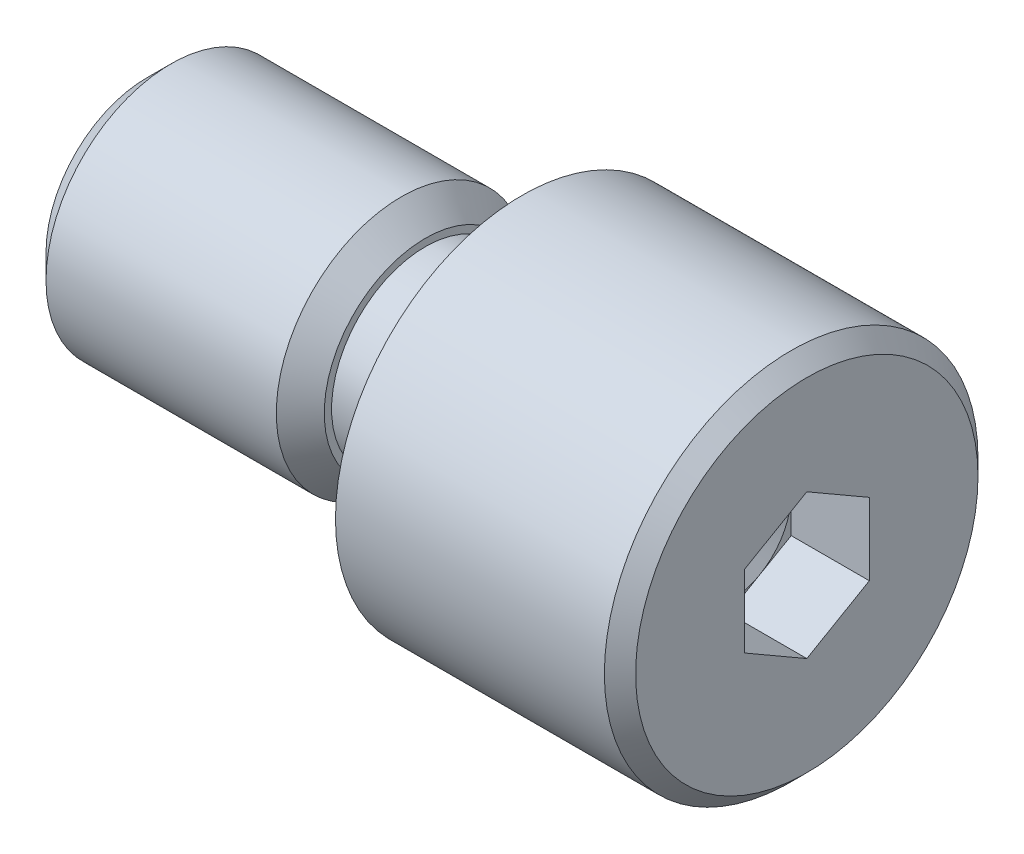
from build123d import *

# Parameters (mm, degrees)
CUT_EXTRUDE1_DEPTH = 2.5
CHAMFER1_SIZE      = 0.767
CHAMFER2_SIZE      = 0.5
FILLET1_R          = 0.2


with BuildPart() as part:
    # Sketch1 → Revolve1 (revolve)
    with BuildSketch(Plane.XY, mode=Mode.PRIVATE) as revolve1_sk:
        Polygon((0, 4), (0, 0), (21.1, 0), (21.1, 5.975), (12, 5.975), (12, 3), (8.9, 3), (8.9, 4), align=None)
    revolve(revolve1_sk.sketch.rotate(Axis((0, 0, 0), (1, 0, 0)), 270), axis=Axis((0, 0, 0), (1, 0, 0)))

    # Sketch2 → Cut-Extrude1 (cut)
    with BuildSketch(Plane(origin=(21.1, 0, 0), x_dir=(0, 0, -1), z_dir=(1, 0, 0))):
        Polygon((0, -2.309401077), (2, -1.154700538), (2, 1.154700538), (0, 2.309401077), (-2, 1.154700538), (-2, -1.154700538), align=None)
    extrude(amount=-CUT_EXTRUDE1_DEPTH, mode=Mode.SUBTRACT)

    # Sketch3 → Cut-Revolve1 (revolve, cut)
    with BuildSketch(Plane(origin=(0, 0, 0), x_dir=(-1, 0, 0), z_dir=(0, 0, -1)), mode=Mode.PRIVATE) as cut_revolve1_sk:
        Polygon((-18.6, 2), (-18.6, 0), (-17.445299462, 0), align=None)
    revolve(cut_revolve1_sk.sketch.rotate(Axis((18.600025, 0, 0), (-1, 0, 0)), 90), axis=Axis((18.600025, 0, 0), (-1, 0, 0)), mode=Mode.SUBTRACT)

    # Chamfer1
    chamfer1_edges = [part.edges().sort_by_distance(p)[0] for p in [
        (0, 0, 4),
        (8.9, 0, 4),
    ]]
    chamfer(chamfer1_edges, length=CHAMFER1_SIZE)

    # Chamfer2
    chamfer2_edges = [part.edges().sort_by_distance(p)[0] for p in [
        (21.1, 0, 5.975),
    ]]
    chamfer(chamfer2_edges, length=CHAMFER2_SIZE)

    # Fillet1
    fillet1_edges = [part.edges().sort_by_distance(p)[0] for p in [
        (12, 0, 3),
    ]]
    fillet(fillet1_edges, radius=FILLET1_R)


solid = part.part
